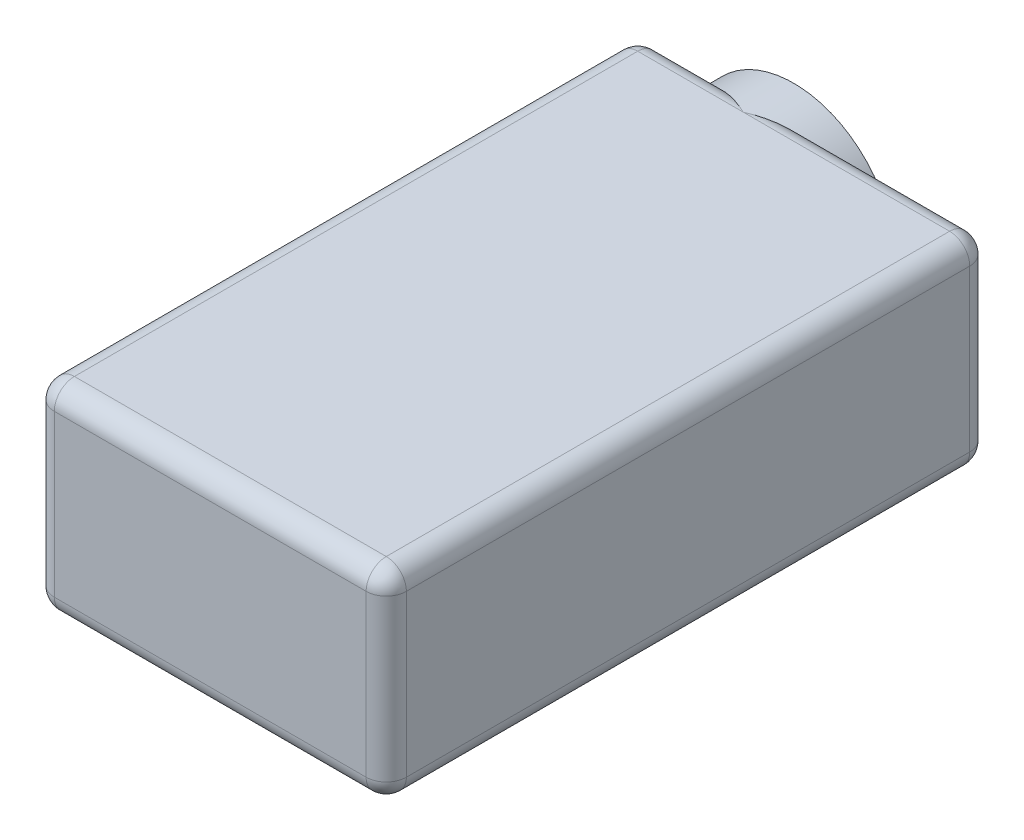
from build123d import *

# Parameters (mm, degrees)
SKETCH1_W                = 35
SKETCH1_H                = 60
BOSS_EXTRUDE1_DEPTH      = 20
FILLET1_R                = 2
BOSS_EXTRUDE2_DEPTH      = 3
BOSS_EXTRUDE2_DEPTH_BACK = 3
SKETCH2_R                = 10
SKETCH3_R                = 6
CUT_EXTRUDE1_DEPTH       = 1


with BuildPart() as part:
    # Sketch1 → Boss-Extrude1 (new body)
    with BuildSketch(Plane(origin=(0, 0, 0), x_dir=(1, 0, 0), z_dir=(0, 1, 0))):
        Rectangle(SKETCH1_W, SKETCH1_H)
    extrude(amount=BOSS_EXTRUDE1_DEPTH)

    # Fillet1
    fillet1_edges = [part.edges().sort_by_distance(p)[0] for p in [
        (-17.5, 20, 0),
        (0, 20, 30),
        (17.5, 20, 0),
        (0, 0, 30),
        (-17.5, 0, 0),
        (0, 0, -30),
        (17.5, 0, 0),
        (0, 20, -30),
        (17.5, 10, 30),
        (-17.5, 10, 30),
        (-17.5, 10, -30),
        (17.5, 10, -30),
    ]]
    fillet(fillet1_edges, radius=FILLET1_R)

    # Sketch2 → Boss-Extrude2 (add, two sides: drawn at the far end of the back side and taken through both)
    with BuildSketch(Plane(origin=(0, 0, -30), x_dir=(-1, 0, 0), z_dir=(0, 0, -1)).offset(-BOSS_EXTRUDE2_DEPTH_BACK)):
        with Locations((5, 10)):
            Circle(SKETCH2_R)
    extrude(amount=BOSS_EXTRUDE2_DEPTH + BOSS_EXTRUDE2_DEPTH_BACK)

    # Sketch3 → Cut-Extrude1 (cut)
    with BuildSketch(Plane(origin=(0, 0, -33), x_dir=(-1, 0, 0), z_dir=(0, 0, -1))):
        with Locations((5, 10)):
            Circle(SKETCH3_R)
    extrude(amount=-CUT_EXTRUDE1_DEPTH, mode=Mode.SUBTRACT)


solid = part.part
